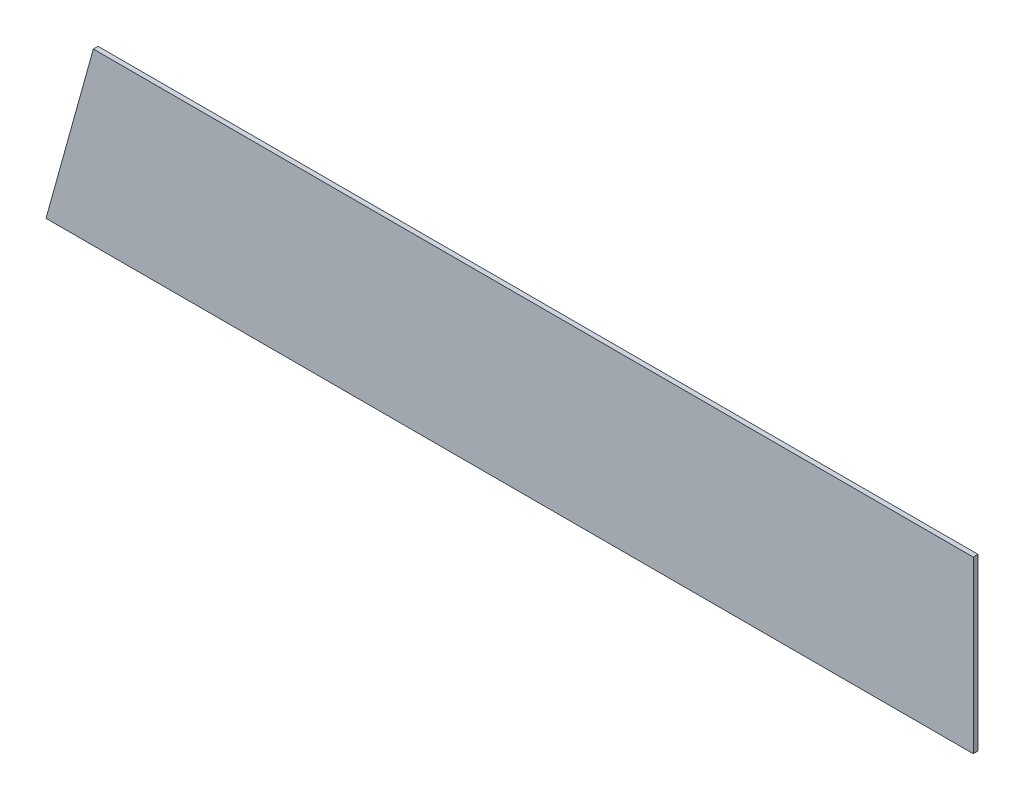
from build123d import *

# Parameters (mm, degrees)
SALIENTE_EXTRUIR1_DEPTH = 0.5


with BuildPart() as part:
    # Croquis1 → Saliente-Extruir1 (new body)
    with BuildSketch(Plane.XY):
        Polygon((-38.990604717, 8.278308849), (54.009395283, 8.278308849), (54.009395283, -9.721691151), (-43.990604717, -9.721691151), align=None)
    extrude(amount=SALIENTE_EXTRUIR1_DEPTH)


solid = part.part
